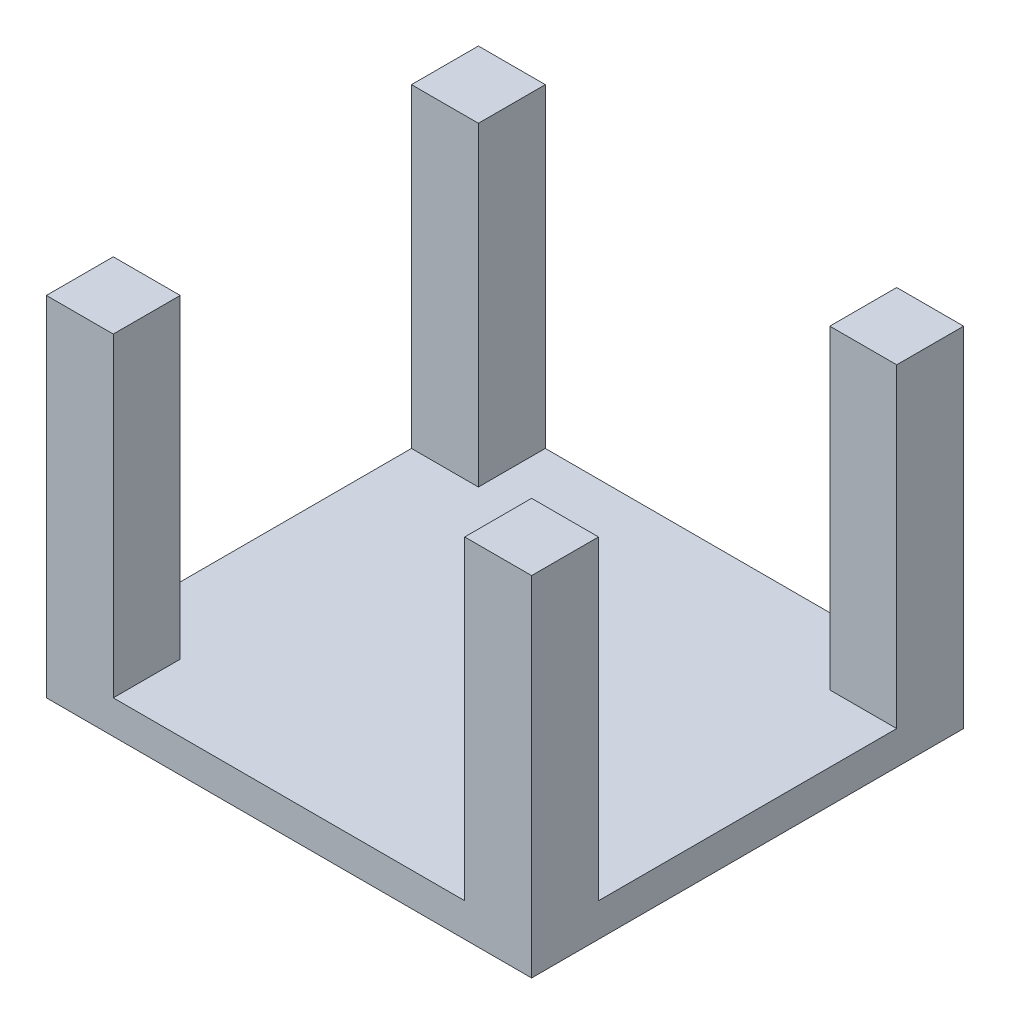
from build123d import *

# Parameters (mm, degrees)
SKETCH1_W           = 92.09999995
SKETCH1_H           = 82
BOSS_EXTRUDE3_DEPTH = 6.35
SKETCH2_W           = 12.7
SKETCH2_H           = 12.7
BOSS_EXTRUDE4_DEPTH = 59.8


with BuildPart() as part:
    # Sketch1 → Boss-Extrude3 (new body)
    with BuildSketch(Plane(origin=(0, 0, 0), x_dir=(1, 0, 0), z_dir=(0, 1, 0))):
        Rectangle(SKETCH1_W, SKETCH1_H)
    extrude(amount=BOSS_EXTRUDE3_DEPTH)

    # Sketch2 → Boss-Extrude4 (add)
    with BuildSketch(Plane(origin=(0, 6.35, 0), x_dir=(1, 0, 0), z_dir=(0, 1, 0))):
        with Locations((-39.699999975, 34.65)):
            Rectangle(SKETCH2_W, SKETCH2_H)
        with Locations((39.699999975, 34.65)):
            Rectangle(SKETCH2_W, SKETCH2_H)
        with Locations((39.699999975, -34.65)):
            Rectangle(SKETCH2_W, SKETCH2_H)
        with Locations((-39.699999975, -34.65)):
            Rectangle(SKETCH2_W, SKETCH2_H)
    extrude(amount=BOSS_EXTRUDE4_DEPTH)


solid = part.part
